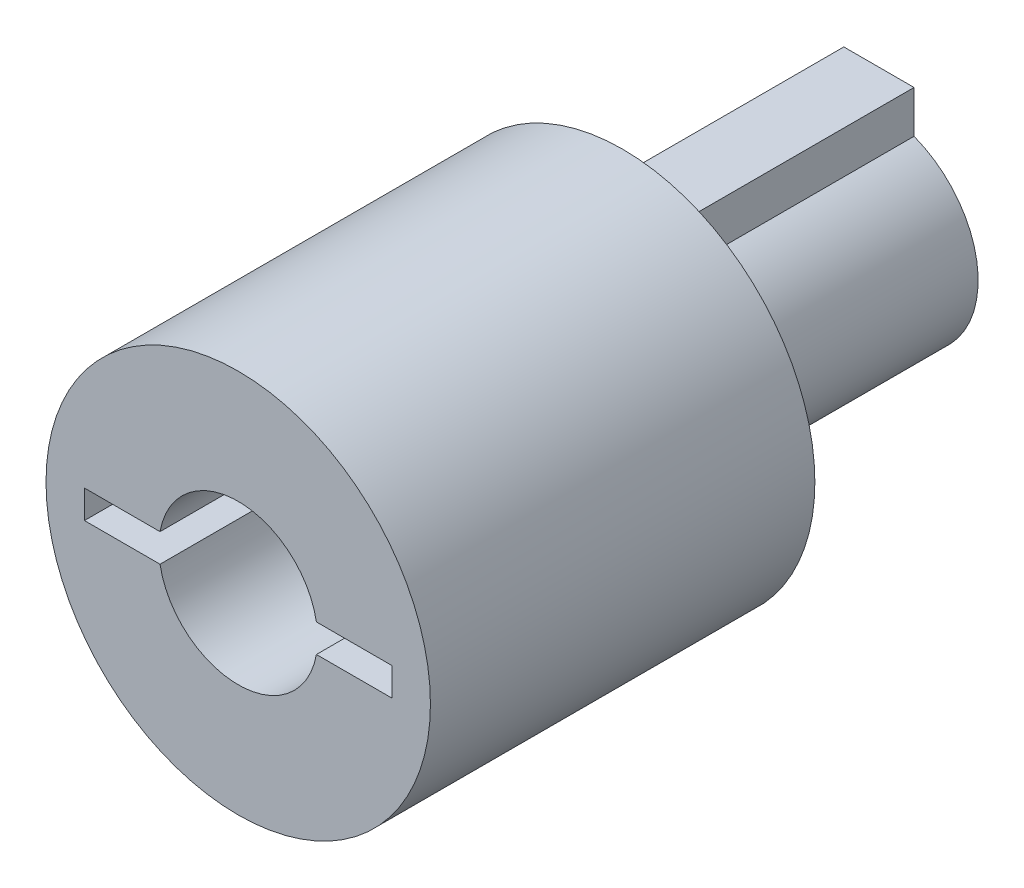
from build123d import *

# Parameters (mm, degrees)
BOSS_EXTRUDE1_DEPTH = 10
SKETCH5_R           = 7.5
BOSS_EXTRUDE2_DEPTH = 15
SKETCH8_R           = 3.1
CUT_EXTRUDE1_DEPTH  = 9
CUT_EXTRUDE2_DEPTH  = 13


with BuildPart() as part:
    # Sketch4 → Boss-Extrude1 (new body)
    with BuildSketch(Plane.XY):
        with BuildLine():
            Line((-1.37, 5.27), (-1.37, 3.619392214))
            ThreePointArc((-1.37, 3.619392214), (0, -3.87), (1.37, 3.619392214))
            Line((1.37, 3.619392214), (1.37, 5.27))
            Line((1.37, 5.27), (-1.37, 5.27))
        make_face()
    extrude(amount=-BOSS_EXTRUDE1_DEPTH)

    # Sketch5 → Boss-Extrude2 (add)
    with BuildSketch(Plane.XY):
        Circle(SKETCH5_R)
    extrude(amount=BOSS_EXTRUDE2_DEPTH)

    # Sketch8 → Cut-Extrude1 (cut)
    with BuildSketch(Plane.XY.offset(15)):
        Circle(SKETCH8_R)
    extrude(amount=-CUT_EXTRUDE1_DEPTH, mode=Mode.SUBTRACT)

    # Sketch9 → Cut-Extrude2 (cut)
    with BuildSketch(Plane.XY.offset(15)):
        with BuildLine():
            Line((-3.1, 0), (0, 0))
            Line((0, 0), (3.1, 0))
            ThreePointArc((3.1, 0), (3.087680411, 0.276097227), (3.050819562, 0.55))
            Line((3.050819562, 0.55), (0, 0.55))
            Line((0, 0.55), (-3.050819562, 0.55))
            ThreePointArc((-3.050819562, 0.55), (-3.087680411, 0.276097227), (-3.1, 0))
        make_face()
        with BuildLine():
            Line((-6, 0), (-3.1, 0))
            ThreePointArc((-3.1, 0), (-3.087680411, 0.276097227), (-3.050819562, 0.55))
            Line((-3.050819562, 0.55), (-6, 0.55))
            Line((-6, 0.55), (-6, 0))
        make_face()
        with BuildLine():
            ThreePointArc((-3.050819562, -0.55), (-3.087680411, -0.276097227), (-3.1, 0))
            Line((-3.1, 0), (-6, 0))
            Line((-6, 0), (-6, -0.55))
            Line((-6, -0.55), (-3.050819562, -0.55))
        make_face()
        with BuildLine():
            Line((3.1, 0), (0, 0))
            Line((0, 0), (-3.1, 0))
            ThreePointArc((-3.1, 0), (-3.087680411, -0.276097227), (-3.050819562, -0.55))
            Line((-3.050819562, -0.55), (0, -0.55))
            Line((0, -0.55), (3.050819562, -0.55))
            ThreePointArc((3.050819562, -0.55), (3.087680411, -0.276097227), (3.1, 0))
        make_face()
        with BuildLine():
            Line((6, 0), (3.1, 0))
            ThreePointArc((3.1, 0), (3.087680411, -0.276097227), (3.050819562, -0.55))
            Line((3.050819562, -0.55), (6, -0.55))
            Line((6, -0.55), (6, 0))
        make_face()
        with BuildLine():
            ThreePointArc((3.050819562, 0.55), (3.087680411, 0.276097227), (3.1, 0))
            Line((3.1, 0), (6, 0))
            Line((6, 0), (6, 0.55))
            Line((6, 0.55), (3.050819562, 0.55))
        make_face()
    extrude(amount=-CUT_EXTRUDE2_DEPTH, mode=Mode.SUBTRACT)


solid = part.part
